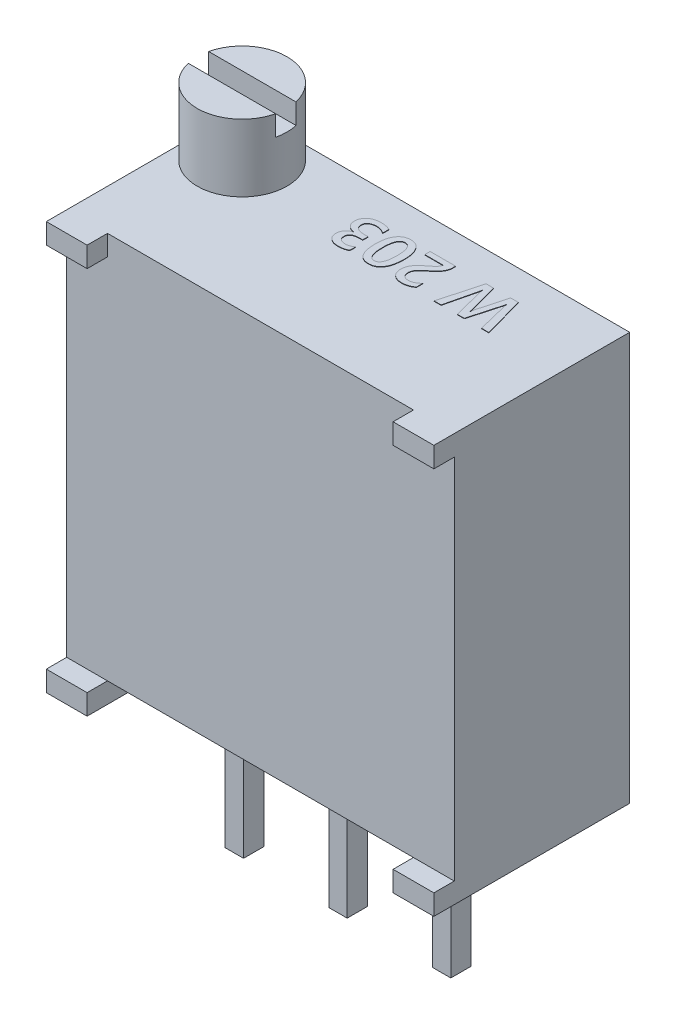
from build123d import *

# Parameters (mm, degrees)
BOSS_EXTRUDE1_DEPTH   = 4.3
SKETCH2_W             = 1
SKETCH2_H             = 0.5
BOSS_EXTRUDE2_DEPTH   = 0.5
SKETCH3_W             = 0.45
SKETCH3_H             = 0.5
BOSS_EXTRUDE3_DEPTH   = 4
BOSS_EXTRUDE3_2_DEPTH = 4
BOSS_EXTRUDE3_3_DEPTH = 4
SKETCH4_R             = 1.1
BOSS_EXTRUDE4_DEPTH   = 1.65
SKETCH5_W             = 2.5
SKETCH5_H             = 0.5
CUT_EXTRUDE1_DEPTH    = 0.5
BOSS_EXTRUDE5_DEPTH   = 0.01
SKETCH7_W             = 0.179487179
SKETCH7_H             = 1
BOSS_EXTRUDE6_DEPTH   = 0.01


with BuildPart() as part:
    # Sketch1 → Boss-Extrude1 (new body)
    with BuildSketch(Plane.XY):
        Polygon((-3.75, -4.75), (3.75, -4.75), (3.75, -5.25), (4.75, -5.25), (4.75, -4.75), (4.75, 4.75), (-4.75, 4.75), (-4.75, -4.75), (-4.75, -5.25), (-3.75, -5.25), align=None)
    extrude(amount=BOSS_EXTRUDE1_DEPTH)

    # Sketch2 → Boss-Extrude2 (add)
    with BuildSketch(Plane.XY.offset(4.3)):
        with Locations((-4.25, -5)):
            Rectangle(SKETCH2_W, SKETCH2_H)
        with Locations((4.25, -5)):
            Rectangle(SKETCH2_W, SKETCH2_H)
        with Locations((-4.25, 4.5)):
            Rectangle(SKETCH2_W, SKETCH2_H)
        with Locations((4.25, 4.5)):
            Rectangle(SKETCH2_W, SKETCH2_H)
    extrude(amount=BOSS_EXTRUDE2_DEPTH)

    # Sketch6 → Boss-Extrude5 (add)
    # profile 1 of 4: a face of its own
    with BuildSketch(Plane(origin=(0, 4.75, 0), x_dir=(1, 0, 0), z_dir=(0, 1, 0))):
        with BuildLine():
            Line((1.697104467, -1.740827386), (1.969925191, -0.740827386))
            Line((1.969925191, -0.740827386), (2.156602823, -0.740827386))
            Line((2.156602823, -0.740827386), (2.345953151, -1.440251728))
            add(Edge.make_bspline(
                [(2.345953151, -1.440251728), (2.349481354, -1.455751325), (2.356806518, -1.487931187), (2.359272146, -1.520846497), (2.360550191, -1.537907978)],
                knots=[0, 0, 0, 0, 0.963310326, 2, 2, 2, 2], degree=3))
            Line((2.360550191, -1.537907978), (2.363222888, -1.537907978))
            add(Edge.make_bspline(
                [(2.363222888, -1.537907978), (2.364797882, -1.521526116), (2.367921887, -1.489032641), (2.37591335, -1.45738372), (2.379875849, -1.441690873)],
                knots=[0, 0, 0, 0, 1.008317034, 2, 2, 2, 2], degree=3))
            Line((2.379875849, -1.441690873), (2.570048546, -0.740827386))
            Line((2.570048546, -0.740827386), (2.76083802, -0.740827386))
            Line((2.76083802, -0.740827386), (3.03920973, -1.740827386))
            Line((3.03920973, -1.740827386), (2.858083086, -1.740827386))
            Line((2.858083086, -1.740827386), (2.677573217, -1.008508307))
            add(Edge.make_bspline(
                [(2.677573217, -1.008508307), (2.674192154, -0.992867389), (2.667329759, -0.96112171), (2.664987027, -0.928725819), (2.663798546, -0.912291202)],
                knots=[0, 0, 0, 0, 0.985388796, 2, 2, 2, 2], degree=3))
            Line((2.663798546, -0.912291202), (2.66030348, -0.912291202))
            add(Edge.make_bspline(
                [(2.66030348, -0.912291202), (2.659640212, -0.918746129), (2.658200294, -0.932759404), (2.653783704, -0.955210106), (2.648091859, -0.980865207), (2.643308348, -0.998930476), (2.64077223, -1.008508307)],
                knots=[0, 0, 0, 0, 0.791790955, 1.718932655, 2.790625439, 4, 4, 4, 4], degree=3))
            Line((2.64077223, -1.008508307), (2.436824862, -1.740827386))
            Line((2.436824862, -1.740827386), (2.266800191, -1.740827386))
            Line((2.266800191, -1.740827386), (2.078066638, -1.00295732))
            add(Edge.make_bspline(
                [(2.078066638, -1.00295732), (2.076492147, -0.996392319), (2.073227537, -0.982780201), (2.069480094, -0.961270494), (2.065840635, -0.938132399), (2.064276351, -0.922033218), (2.063469599, -0.913730346)],
                knots=[0, 0, 0, 0, 0.894988931, 1.855703602, 2.894116632, 4, 4, 4, 4], degree=3))
            Line((2.063469599, -0.913730346), (2.060796901, -0.913730346))
            add(Edge.make_bspline(
                [(2.060796901, -0.913730346), (2.060229838, -0.920040213), (2.059012116, -0.933590109), (2.055941386, -0.955314057), (2.050801785, -0.979652109), (2.046846147, -0.996796835), (2.044760717, -1.005835609)],
                knots=[0, 0, 0, 0, 0.812174724, 1.74407555, 2.810666704, 4, 4, 4, 4], degree=3))
            Line((2.044760717, -1.005835609), (1.867951507, -1.740827386))
            Line((1.867951507, -1.740827386), (1.697104467, -1.740827386))
        make_face()
    # profile 2 of 4: a face of its own
    with BuildSketch(Plane(origin=(0, 4.75, 0), x_dir=(1, 0, 0), z_dir=(0, 1, 0))):
        with BuildLine():
            Line((0.598831441, -0.740827386), (1.223214665, -0.740827386))
            Line((1.223214665, -0.740827386), (1.223214665, -0.813812583))
            add(Edge.make_bspline(
                [(1.223214665, -0.813812583), (1.223063796, -0.821221518), (1.222765395, -0.835875506), (1.220147953, -0.85772297), (1.216140054, -0.879188212), (1.208361523, -0.907107739), (1.195435505, -0.940751899), (1.175323007, -0.978928145), (1.151178875, -1.014902269), (1.122837621, -1.048311288), (1.091899621, -1.080329827), (1.058917452, -1.111137302), (1.024520802, -1.140807695), (0.989630078, -1.169699196), (0.954469781, -1.197921452), (0.931451436, -1.217081514), (0.919966309, -1.226641531)],
                knots=[0, 0, 0, 0, 0.585695841, 1.1584363, 1.737703347, 2.310930754, 3.448241923, 4.580285727, 5.716615164, 6.867072204, 8.039917194, 9.236143289, 10.434724066, 11.631674228, 12.818311132, 14, 14, 14, 14], degree=3))
            add(Edge.make_bspline(
                [(0.919966309, -1.226641531), (0.909766271, -1.235624059), (0.889962237, -1.25306422), (0.86207785, -1.279499675), (0.837127507, -1.306035465), (0.816263462, -1.333819235), (0.799300365, -1.362930288), (0.78649894, -1.393576025), (0.778557756, -1.426629466), (0.777582407, -1.449458179), (0.777079796, -1.461222123)],
                knots=[0, 0, 0, 0, 1.146517297, 2.226037423, 3.240694149, 4.215431384, 5.150528787, 6.075997236, 7.008535445, 8, 8, 8, 8], degree=3))
            add(Edge.make_bspline(
                [(0.777079796, -1.461222123), (0.77723676, -1.467740783), (0.777540124, -1.480339387), (0.779903318, -1.498625395), (0.783411006, -1.515707992), (0.788919559, -1.53140217), (0.795411732, -1.545968043), (0.803540224, -1.559089795), (0.812586823, -1.571171236), (0.822951055, -1.581931562), (0.834514294, -1.591392979), (0.847090227, -1.599598872), (0.860565877, -1.606674106), (0.880028938, -1.614398169), (0.906687925, -1.6208858), (0.928764817, -1.621890055), (0.940114336, -1.622406333)],
                knots=[0, 0, 0, 0, 1.054824817, 2.038658003, 2.980829736, 3.871915045, 4.725761204, 5.557188573, 6.364814103, 7.165091863, 7.969051903, 8.778275864, 9.592049471, 10.428420805, 12.163885205, 14, 14, 14, 14], degree=3))
            add(Edge.make_bspline(
                [(0.940114336, -1.622406333), (0.950347482, -1.622025692), (0.971084598, -1.621254335), (1.002171835, -1.615663603), (1.033525132, -1.60675338), (1.064885559, -1.594119206), (1.096246721, -1.578127486), (1.126881495, -1.558090504), (1.157316218, -1.534994561), (1.176162249, -1.51706014), (1.185796901, -1.507891531)],
                knots=[0, 0, 0, 0, 0.883493664, 1.790369133, 2.719623939, 3.694504142, 4.705684263, 5.754764511, 6.852168812, 8, 8, 8, 8], degree=3))
            Line((1.185796901, -1.507891531), (1.185796901, -1.662907978))
            add(Edge.make_bspline(
                [(1.185796901, -1.662907978), (1.175622414, -1.670258535), (1.155679728, -1.684666124), (1.124428811, -1.703314019), (1.092433479, -1.718780855), (1.059615678, -1.731936381), (1.025227854, -1.742112607), (0.989001163, -1.749006089), (0.950697519, -1.753171818), (0.924431728, -1.753708965), (0.910920257, -1.753985281)],
                knots=[0, 0, 0, 0, 1.020217626, 1.999695649, 2.954129611, 3.907082353, 4.871483213, 5.864810139, 6.901630029, 8, 8, 8, 8], degree=3))
            add(Edge.make_bspline(
                [(0.910920257, -1.753985281), (0.899944022, -1.753838162), (0.87848047, -1.753550477), (0.847094745, -1.749827286), (0.817228196, -1.744424536), (0.788976158, -1.736668315), (0.762639859, -1.726476741), (0.737958269, -1.714689827), (0.715473743, -1.700377653), (0.694911191, -1.684068653), (0.676550198, -1.665498971), (0.660446881, -1.644731141), (0.646328011, -1.621981395), (0.634637885, -1.597002724), (0.625347008, -1.569994154), (0.618920717, -1.541023209), (0.614577468, -1.510215569), (0.614225983, -1.488992951), (0.614045257, -1.478080675)],
                knots=[0, 0, 0, 0, 1.145543965, 2.240061654, 3.295540143, 4.312948294, 5.293759512, 6.241105975, 7.164277889, 8.070655315, 8.976439294, 9.88400245, 10.809445939, 11.766606939, 12.757831477, 13.785531283, 14.861361287, 16, 16, 16, 16], degree=3))
            add(Edge.make_bspline(
                [(0.614045257, -1.478080675), (0.614274215, -1.468207674), (0.61472185, -1.448905099), (0.617294014, -1.420633556), (0.62210177, -1.393933953), (0.628407073, -1.368595802), (0.636820966, -1.344546665), (0.646636431, -1.321399846), (0.657969075, -1.299027197), (0.671062561, -1.27763972), (0.685423564, -1.256740543), (0.701619195, -1.236707231), (0.718792169, -1.216848322), (0.744475269, -1.190998448), (0.779383255, -1.15839091), (0.809039378, -1.133311645), (0.82436598, -1.120350412)],
                knots=[0, 0, 0, 0, 0.960422525, 1.877709569, 2.757692884, 3.59673609, 4.414622526, 5.232970578, 6.040827254, 6.851319506, 7.670427297, 8.505303329, 9.355576882, 10.222871562, 12.04793961, 14, 14, 14, 14], degree=3))
            add(Edge.make_bspline(
                [(0.82436598, -1.120350412), (0.837695836, -1.109480538), (0.864181193, -1.087882967), (0.903862983, -1.056738396), (0.94146313, -1.026350281), (0.97555324, -0.996590955), (1.00473997, -0.967058619), (1.024688843, -0.94169429), (1.036674552, -0.921267569), (1.0430059, -0.906234329), (1.046900133, -0.891107384), (1.047394871, -0.880925696), (1.047639007, -0.875901399)],
                knots=[0, 0, 0, 0, 1.519319933, 3.018767352, 4.455867251, 5.789607442, 7.013970974, 8.119420078, 8.629257675, 9.101441908, 9.55659382, 10, 10, 10, 10], degree=3))
            Line((1.047639007, -0.875901399), (1.047639007, -0.872406333))
            Line((1.047639007, -0.872406333), (0.598831441, -0.872406333))
            Line((0.598831441, -0.872406333), (0.598831441, -0.740827386))
        make_face()
    # profile 3 of 4: a face of its own
    with BuildSketch(Plane(origin=(0, 4.75, 0), x_dir=(1, 0, 0), z_dir=(0, 1, 0))):
        with BuildLine():
            add(Edge.make_bspline(
                [(0.118157099, -0.727669491), (0.130791593, -0.72805702), (0.155453254, -0.728813451), (0.191347305, -0.734938786), (0.225117321, -0.744805127), (0.256873898, -0.7585849), (0.286279065, -0.776749909), (0.313602604, -0.798665967), (0.338644744, -0.824706542), (0.361457304, -0.854581186), (0.381665196, -0.888263301), (0.399825732, -0.925195065), (0.414314507, -0.966009555), (0.426794305, -1.010059924), (0.435993253, -1.057821363), (0.443094935, -1.108928031), (0.446824004, -1.163675022), (0.447415906, -1.201280314), (0.447721244, -1.220679359)],
                knots=[0, 0, 0, 0, 0.908194589, 1.772733203, 2.610198082, 3.433401534, 4.254166997, 5.088537112, 5.945966099, 6.845966122, 7.785889167, 8.766785405, 9.80052806, 10.895912427, 12.056765169, 13.295366077, 14.604788982, 16, 16, 16, 16], degree=3))
            add(Edge.make_bspline(
                [(0.447721244, -1.220679359), (0.447469784, -1.241932646), (0.446981723, -1.283183383), (0.442521891, -1.343010411), (0.43581371, -1.398947854), (0.425657279, -1.450839658), (0.413105879, -1.498883053), (0.39752545, -1.542886841), (0.378998663, -1.582854085), (0.357634885, -1.618807973), (0.333546493, -1.650589967), (0.307033861, -1.678344237), (0.277800538, -1.701794978), (0.245989125, -1.720984124), (0.211659034, -1.736018198), (0.174768519, -1.74633684), (0.135458696, -1.752947232), (0.10838479, -1.753633622), (0.094514007, -1.753985281)],
                knots=[0, 0, 0, 0, 1.412202202, 2.740958721, 3.984857896, 5.154044097, 6.252128862, 7.282102455, 8.25196091, 9.175176518, 10.056000901, 10.896678907, 11.719614964, 12.538951468, 13.358844723, 14.202133996, 15.078898714, 16, 16, 16, 16], degree=3))
            add(Edge.make_bspline(
                [(0.094514007, -1.753985281), (0.08126312, -1.753600211), (0.055443601, -1.752849898), (0.017986802, -1.74673435), (-0.017040185, -1.737014601), (-0.049389832, -1.722902002), (-0.07909995, -1.704817421), (-0.106313132, -1.682800719), (-0.130855482, -1.656684281), (-0.152737211, -1.626605074), (-0.171898295, -1.592537765), (-0.18844492, -1.554537056), (-0.202673437, -1.512603357), (-0.213975247, -1.466622001), (-0.223042849, -1.4167817), (-0.229198413, -1.363004904), (-0.23323563, -1.305308273), (-0.233618664, -1.265505847), (-0.233816585, -1.244939228)],
                knots=[0, 0, 0, 0, 0.927272819, 1.806802712, 2.649751481, 3.466272407, 4.269403807, 5.077948948, 5.90951417, 6.771315089, 7.675916582, 8.640522845, 9.669262054, 10.772456733, 11.952629878, 13.213732683, 14.560286302, 16, 16, 16, 16], degree=3))
            add(Edge.make_bspline(
                [(-0.233816585, -1.244939228), (-0.233557674, -1.22457714), (-0.233054054, -1.184969902), (-0.228672515, -1.127453484), (-0.221694229, -1.073572385), (-0.211308516, -1.023542944), (-0.198651552, -0.977067833), (-0.18239271, -0.934531303), (-0.163937687, -0.895392573), (-0.141977882, -0.860385952), (-0.117752504, -0.829079534), (-0.090874501, -0.801963896), (-0.061691, -0.778936714), (-0.030243018, -0.759995831), (0.003662493, -0.745623215), (0.039702427, -0.735002044), (0.078195068, -0.728800456), (0.104634186, -0.728052203), (0.118157099, -0.727669491)],
                knots=[0, 0, 0, 0, 1.38560465, 2.695203706, 3.923414753, 5.08051981, 6.170289562, 7.197649644, 8.176009219, 9.110401701, 10.004207552, 10.864985215, 11.70194331, 12.528215922, 13.355593529, 14.201278052, 15.080001062, 16, 16, 16, 16], degree=3))
        make_face()
        with BuildLine():
            add(Edge.make_bspline(
                [(0.102120915, -1.622406333), (0.109486281, -1.622192568), (0.1238329, -1.621776186), (0.14450597, -1.616682511), (0.163956153, -1.609217333), (0.181719844, -1.597953269), (0.19845217, -1.584166159), (0.213170728, -1.566777951), (0.226653544, -1.546557429), (0.238716989, -1.523328517), (0.249092192, -1.496938827), (0.25839091, -1.467630653), (0.266047441, -1.435172846), (0.272395354, -1.399688281), (0.277281642, -1.36118995), (0.280631249, -1.319546629), (0.283039364, -1.274846685), (0.283176763, -1.243983306), (0.283247559, -1.228080675)],
                knots=[0, 0, 0, 0, 0.735362069, 1.432374033, 2.118779267, 2.811561237, 3.527183876, 4.280708889, 5.081467683, 5.955679666, 6.894233009, 7.915781384, 9.0302243, 10.228785287, 11.521728145, 12.91191762, 14.408838127, 16, 16, 16, 16], degree=3))
            add(Edge.make_bspline(
                [(0.283247559, -1.228080675), (0.283153891, -1.213206842), (0.2829725, -1.184403236), (0.280878036, -1.142569375), (0.277504851, -1.103595824), (0.272533143, -1.067522615), (0.266494246, -1.034335731), (0.258939489, -1.004025576), (0.249913947, -0.976515569), (0.239524061, -0.951859156), (0.227813576, -0.930006013), (0.214624734, -0.911104499), (0.199952596, -0.895052416), (0.183788967, -0.881979998), (0.166286398, -0.87168555), (0.147320684, -0.864468568), (0.126929163, -0.860016315), (0.112834897, -0.859508523), (0.10561598, -0.859248438)],
                knots=[0, 0, 0, 0, 1.571596828, 3.04344242, 4.424859977, 5.704017907, 6.889997985, 7.987729224, 9.002212153, 9.94644074, 10.811633262, 11.617285478, 12.375763891, 13.101849371, 13.806082749, 14.512138209, 15.237934729, 16, 16, 16, 16], degree=3))
            add(Edge.make_bspline(
                [(0.10561598, -0.859248438), (0.098534702, -0.859511081), (0.084712879, -0.860023729), (0.064625066, -0.864457488), (0.045956469, -0.871912592), (0.02865925, -0.882403485), (0.012713534, -0.895693931), (-0.001814211, -0.9119725), (-0.014726933, -0.931271724), (-0.026177616, -0.953477094), (-0.036471723, -0.978428919), (-0.045211388, -1.006393716), (-0.05278935, -1.037216362), (-0.058894174, -1.071003912), (-0.063504691, -1.107661485), (-0.067015363, -1.147225852), (-0.06905695, -1.189750227), (-0.069245561, -1.219100924), (-0.069342901, -1.234248438)],
                knots=[0, 0, 0, 0, 0.74148903, 1.447299324, 2.143506309, 2.83945391, 3.558586653, 4.311330362, 5.118123385, 5.985524726, 6.925864811, 7.943480589, 9.053125395, 10.250577148, 11.53966483, 12.924071925, 14.412553285, 16, 16, 16, 16], degree=3))
            add(Edge.make_bspline(
                [(-0.069342901, -1.234248438), (-0.069256872, -1.249945019), (-0.069090744, -1.280256303), (-0.066904853, -1.324269413), (-0.063820757, -1.36523533), (-0.059008699, -1.403219624), (-0.053247913, -1.438128677), (-0.045795151, -1.470050488), (-0.037116021, -1.498946705), (-0.026966476, -1.524840469), (-0.015897768, -1.5478391), (-0.002888655, -1.567539081), (0.010892915, -1.584682311), (0.026632618, -1.598410685), (0.043517505, -1.609366095), (0.062012606, -1.616643215), (0.081558459, -1.621773112), (0.095164397, -1.622192107), (0.102120915, -1.622406333)],
                knots=[0, 0, 0, 0, 1.611006825, 3.110976005, 4.522342957, 5.826738026, 7.039854268, 8.152351257, 9.189293333, 10.133733214, 11.005142595, 11.803131833, 12.552481119, 13.255248608, 13.938270181, 14.607089561, 15.287825258, 16, 16, 16, 16], degree=3))
        make_face(mode=Mode.SUBTRACT)
    # profile 4 of 4: a face of its own
    with BuildSketch(Plane(origin=(0, 4.75, 0), x_dir=(1, 0, 0), z_dir=(0, 1, 0))):
        with BuildLine():
            Line((-0.373002441, -0.780917846), (-0.373002441, -0.932028044))
            add(Edge.make_bspline(
                [(-0.373002441, -0.932028044), (-0.38113445, -0.926201487), (-0.397258025, -0.914649003), (-0.422895333, -0.899868456), (-0.449236858, -0.887333515), (-0.476324182, -0.876839754), (-0.504347692, -0.869230833), (-0.532951951, -0.863306885), (-0.562414763, -0.860047283), (-0.582287922, -0.859517293), (-0.592369217, -0.859248438)],
                knots=[0, 0, 0, 0, 1.020040626, 2.02246448, 3.013734284, 3.993997349, 4.98119114, 5.972460943, 6.971466046, 8, 8, 8, 8], degree=3))
            add(Edge.make_bspline(
                [(-0.592369217, -0.859248438), (-0.600391694, -0.859348391), (-0.616121825, -0.859544373), (-0.639068948, -0.861614356), (-0.660854243, -0.865095956), (-0.681323245, -0.870018961), (-0.7006199, -0.876147488), (-0.718636744, -0.883823214), (-0.73543138, -0.892822359), (-0.75095022, -0.903042018), (-0.76463729, -0.914652257), (-0.777065512, -0.926884792), (-0.787006429, -0.940682982), (-0.795702112, -0.955055466), (-0.801913713, -0.970676655), (-0.806867769, -0.987070444), (-0.809398802, -1.004593298), (-0.809857685, -1.016588577), (-0.810091256, -1.022694162)],
                knots=[0, 0, 0, 0, 1.258895949, 2.468389337, 3.612503448, 4.718673703, 5.769764423, 6.786671876, 7.787639893, 8.757195985, 9.696445932, 10.601570915, 11.485745881, 12.35832979, 13.231245116, 14.116270219, 15.04118342, 16, 16, 16, 16], degree=3))
            add(Edge.make_bspline(
                [(-0.810091256, -1.022694162), (-0.80990817, -1.029356016), (-0.809549376, -1.042411273), (-0.806332599, -1.061281949), (-0.801594732, -1.079018073), (-0.794116466, -1.095187068), (-0.785174113, -1.110325271), (-0.773928072, -1.124031786), (-0.760503085, -1.136215505), (-0.745326169, -1.147346768), (-0.72801939, -1.157002332), (-0.708790404, -1.165538125), (-0.687335206, -1.172272872), (-0.66411663, -1.178343149), (-0.638819813, -1.18284909), (-0.611470361, -1.185717562), (-0.582125514, -1.187946664), (-0.561877772, -1.188111148), (-0.551456388, -1.188195807)],
                knots=[0, 0, 0, 0, 0.919773204, 1.802482531, 2.638870844, 3.448454622, 4.255597885, 5.063129906, 5.887422618, 6.75491477, 7.658160222, 8.620620861, 9.656755447, 10.761500027, 11.935428112, 13.202873052, 14.560336558, 16, 16, 16, 16], degree=3))
            Line((-0.551456388, -1.188195807), (-0.474359349, -1.188195807))
            Line((-0.474359349, -1.188195807), (-0.474359349, -1.319774754))
            Line((-0.474359349, -1.319774754), (-0.547961322, -1.319774754))
            add(Edge.make_bspline(
                [(-0.547961322, -1.319774754), (-0.557216171, -1.319886442), (-0.575197113, -1.320103437), (-0.601277831, -1.321964344), (-0.625585786, -1.324992592), (-0.648061718, -1.329260504), (-0.668748775, -1.33482172), (-0.687714334, -1.341515243), (-0.70480878, -1.349588652), (-0.720286206, -1.358560627), (-0.733713026, -1.369207862), (-0.745549902, -1.380919533), (-0.755524036, -1.393993161), (-0.763562742, -1.40836184), (-0.769969606, -1.423806346), (-0.774518768, -1.440514713), (-0.777211767, -1.458460687), (-0.77747326, -1.470875406), (-0.777607704, -1.477258307)],
                knots=[0, 0, 0, 0, 1.404501108, 2.728759148, 3.965970751, 5.120544592, 6.19790431, 7.214506404, 8.168354262, 9.063819676, 9.923158143, 10.761596165, 11.585390412, 12.409775404, 13.253871661, 14.116853272, 15.031799295, 16, 16, 16, 16], degree=3))
            add(Edge.make_bspline(
                [(-0.777607704, -1.477258307), (-0.777534558, -1.483092432), (-0.777391965, -1.494465712), (-0.774972856, -1.510963595), (-0.771534331, -1.526377233), (-0.76693063, -1.540775311), (-0.760367249, -1.55376152), (-0.752780436, -1.565905126), (-0.7435462, -1.576751324), (-0.732779061, -1.586326885), (-0.720916798, -1.594957709), (-0.70756865, -1.602496252), (-0.692714619, -1.608488464), (-0.676603141, -1.613743474), (-0.659020596, -1.617517962), (-0.640081716, -1.620444344), (-0.619739156, -1.622012925), (-0.605735029, -1.622272773), (-0.59853698, -1.622406333)],
                knots=[0, 0, 0, 0, 1.061395487, 2.069127569, 3.028812431, 3.936457015, 4.81267355, 5.671205055, 6.538848535, 7.39592767, 8.289566421, 9.205919675, 10.179300053, 11.201455343, 12.288367393, 13.44967409, 14.689145545, 16, 16, 16, 16], degree=3))
            add(Edge.make_bspline(
                [(-0.59853698, -1.622406333), (-0.59023095, -1.622240273), (-0.57375767, -1.621910926), (-0.54932288, -1.618295646), (-0.525083155, -1.613384878), (-0.501386479, -1.605586793), (-0.477873592, -1.596141413), (-0.454906577, -1.584322349), (-0.432175713, -1.570582943), (-0.41774271, -1.559953652), (-0.410420204, -1.554560938)],
                knots=[0, 0, 0, 0, 0.977927317, 1.939514914, 2.905635295, 3.888849374, 4.874051084, 5.888857151, 6.928923011, 8, 8, 8, 8], degree=3))
            Line((-0.410420204, -1.554560938), (-0.410420204, -1.697241859))
            add(Edge.make_bspline(
                [(-0.410420204, -1.697241859), (-0.418987214, -1.701835271), (-0.436218496, -1.711074242), (-0.463443542, -1.722463476), (-0.491757286, -1.732147738), (-0.521132482, -1.740194036), (-0.551716708, -1.746303142), (-0.583416611, -1.750851969), (-0.616306973, -1.75356787), (-0.638622365, -1.753844862), (-0.649935006, -1.753985281)],
                knots=[0, 0, 0, 0, 0.937084458, 1.884807541, 2.842116104, 3.82179766, 4.819900794, 5.848100763, 6.90910883, 8, 8, 8, 8], degree=3))
            add(Edge.make_bspline(
                [(-0.649935006, -1.753985281), (-0.660700585, -1.7537904), (-0.681729616, -1.753409729), (-0.712480004, -1.750369221), (-0.741504832, -1.744912319), (-0.769049583, -1.737910145), (-0.794802564, -1.728235615), (-0.819220254, -1.717134118), (-0.841721341, -1.703376802), (-0.862466071, -1.687829663), (-0.881042757, -1.670599523), (-0.897609823, -1.652294869), (-0.911070647, -1.632334825), (-0.922591563, -1.61159463), (-0.931224492, -1.589428839), (-0.937647413, -1.566239414), (-0.941396811, -1.541730154), (-0.941850229, -1.52503688), (-0.942081388, -1.516526399)],
                knots=[0, 0, 0, 0, 1.223600096, 2.390129341, 3.506991535, 4.578292298, 5.615841666, 6.629967304, 7.622563525, 8.607180547, 9.571875333, 10.498880206, 11.406369787, 12.302217071, 13.190377456, 14.103134075, 15.032949347, 16, 16, 16, 16], degree=3))
            add(Edge.make_bspline(
                [(-0.942081388, -1.516526399), (-0.941913091, -1.50850314), (-0.941584441, -1.492835253), (-0.939319978, -1.469873848), (-0.935448154, -1.447999642), (-0.929873693, -1.427253126), (-0.922910012, -1.407532436), (-0.914194238, -1.389006047), (-0.904114083, -1.371403668), (-0.892397292, -1.354892666), (-0.878892143, -1.339676202), (-0.864101816, -1.325436646), (-0.847668369, -1.312336521), (-0.829555238, -1.300518483), (-0.809966944, -1.289615761), (-0.788926663, -1.279676296), (-0.766212894, -1.271049355), (-0.750364407, -1.266291143), (-0.742245862, -1.263853702)],
                knots=[0, 0, 0, 0, 1.098595234, 2.145346005, 3.15592675, 4.137015446, 5.083892102, 6.015911009, 6.936617318, 7.858422922, 8.782709067, 9.71854687, 10.666771129, 11.655816299, 12.676671095, 13.734552038, 14.839501629, 16, 16, 16, 16], degree=3))
            Line((-0.742245862, -1.263853702), (-0.742245862, -1.261181004))
            add(Edge.make_bspline(
                [(-0.742245862, -1.261181004), (-0.750968968, -1.26014416), (-0.768103579, -1.25810751), (-0.792917602, -1.252940643), (-0.816413055, -1.246196641), (-0.838345775, -1.237473847), (-0.859119246, -1.227483144), (-0.878362803, -1.215416233), (-0.896176612, -1.201695458), (-0.912515701, -1.186426345), (-0.92705127, -1.169783034), (-0.939905075, -1.152093466), (-0.950599248, -1.133316938), (-0.959350497, -1.113546533), (-0.966051044, -1.092787368), (-0.971093077, -1.071003437), (-0.973929111, -1.048194118), (-0.974350997, -1.032638529), (-0.974564941, -1.024750083)],
                knots=[0, 0, 0, 0, 1.147413426, 2.253839573, 3.308008183, 4.33735214, 5.334565654, 6.316054888, 7.299380704, 8.268702586, 9.233255888, 10.182642181, 11.121197407, 12.051341855, 13.002837429, 13.967349162, 14.969215829, 16, 16, 16, 16], degree=3))
            add(Edge.make_bspline(
                [(-0.974564941, -1.024750083), (-0.974249505, -1.013904131), (-0.973631493, -0.992654376), (-0.968757649, -0.961568621), (-0.960980978, -0.93205073), (-0.950128195, -0.904074771), (-0.93568841, -0.877953917), (-0.918281899, -0.853374114), (-0.897908594, -0.830162218), (-0.874104381, -0.809211488), (-0.848191245, -0.789830801), (-0.819880333, -0.773195016), (-0.789583996, -0.759093664), (-0.757264097, -0.747689806), (-0.723043508, -0.738569308), (-0.686782996, -0.732315965), (-0.648587628, -0.72828238), (-0.622396311, -0.727876663), (-0.609022177, -0.727669491)],
                knots=[0, 0, 0, 0, 0.983940476, 1.927769423, 2.84802486, 3.750045942, 4.643514009, 5.549450475, 6.479157115, 7.439340576, 8.422041893, 9.411900921, 10.413607991, 11.450326742, 12.518416784, 13.623775064, 14.786622743, 16, 16, 16, 16], degree=3))
            add(Edge.make_bspline(
                [(-0.609022177, -0.727669491), (-0.597024525, -0.727817452), (-0.573619524, -0.728106095), (-0.539446627, -0.730636467), (-0.507013963, -0.734619547), (-0.476560408, -0.740628986), (-0.447836602, -0.747921014), (-0.421195543, -0.757302381), (-0.396034788, -0.767751125), (-0.380597191, -0.776576215), (-0.373002441, -0.780917846)],
                knots=[0, 0, 0, 0, 1.175824548, 2.293796582, 3.356926285, 4.376576327, 5.334578578, 6.258657363, 7.143321063, 8, 8, 8, 8], degree=3))
        make_face()
    extrude(amount=BOSS_EXTRUDE5_DEPTH)

    # Sketch7 → Boss-Extrude6 (add)
    # profile 1 of 13: a face of its own
    with BuildSketch(Plane(origin=(0, 0, 0), x_dir=(-1, 0, 0), z_dir=(0, 0, -1))):
        Polygon((-2.975524587, 1.868364311), (-2.437063048, 1.868364311), (-2.437063048, 1.688877132), (-2.616550228, 1.688877132), (-2.616550228, 0.868364311), (-2.796037407, 0.868364311), (-2.796037407, 1.688877132), (-2.975524587, 1.688877132), align=None)
    # profile 2 of 13: a face of its own
    with BuildSketch(Plane(origin=(0, 0, 0), x_dir=(-1, 0, 0), z_dir=(0, 0, -1))):
        with BuildLine():
            Line((-2.296037407, 1.868364311), (-2.086902792, 1.868364311))
            add(Edge.make_bspline(
                [(-2.086902792, 1.868364311), (-2.073079057, 1.868315245), (-2.046492122, 1.868220876), (-2.008155214, 1.866731994), (-1.972937491, 1.864660091), (-1.940786811, 1.861498313), (-1.911716929, 1.857306177), (-1.885698709, 1.852364342), (-1.862732913, 1.846732062), (-1.842625854, 1.839713797), (-1.824480228, 1.831797301), (-1.807565982, 1.822701101), (-1.791509963, 1.812526487), (-1.776419487, 1.801005737), (-1.762163414, 1.788346107), (-1.748714851, 1.774534854), (-1.736263837, 1.759454863), (-1.72488747, 1.743201422), (-1.714518827, 1.726103174), (-1.705355121, 1.708136644), (-1.69790318, 1.689289337), (-1.691318592, 1.669833638), (-1.686575926, 1.649491424), (-1.683277471, 1.628460729), (-1.680862472, 1.606667522), (-1.680723621, 1.591862186), (-1.680652792, 1.584309824)],
                knots=[0, 0, 0, 0, 1.749336639, 3.364467119, 4.854658419, 6.213483162, 7.451590619, 8.570285859, 9.5643256, 10.440900261, 11.26203566, 12.067320669, 12.869050712, 13.665104639, 14.467235401, 15.27997916, 16.102287765, 16.939272006, 17.78853747, 18.631303466, 19.488103222, 20.351255419, 21.228522269, 22.127379805, 23.044756219, 24, 24, 24, 24], degree=3))
            add(Edge.make_bspline(
                [(-1.680652792, 1.584309824), (-1.680836781, 1.576426893), (-1.68119755, 1.560969902), (-1.68314085, 1.538264843), (-1.686692591, 1.51654223), (-1.69207222, 1.495865666), (-1.698255404, 1.475977805), (-1.706477453, 1.457245592), (-1.715756849, 1.439396593), (-1.726777715, 1.422683289), (-1.738872578, 1.406734445), (-1.752938649, 1.39216112), (-1.768064663, 1.378180052), (-1.785100908, 1.365666969), (-1.80329641, 1.353775781), (-1.823012696, 1.342999198), (-1.84412109, 1.333066321), (-1.858961336, 1.327527063), (-1.866550228, 1.324694439)],
                knots=[0, 0, 0, 0, 1.099860209, 2.156625411, 3.176576793, 4.16617041, 5.135385252, 6.078461593, 7.016046972, 7.938469504, 8.868247731, 9.803980173, 10.76021508, 11.73834243, 12.748633912, 13.790971185, 14.870363756, 16, 16, 16, 16], degree=3))
            Line((-1.866550228, 1.324694439), (-1.635780997, 0.868364311))
            Line((-1.635780997, 0.868364311), (-1.835300228, 0.868364311))
            Line((-1.835300228, 0.868364311), (-2.055652792, 1.304261747))
            Line((-2.055652792, 1.304261747), (-2.116550228, 1.304261747))
            Line((-2.116550228, 1.304261747), (-2.116550228, 0.868364311))
            Line((-2.116550228, 0.868364311), (-2.296037407, 0.868364311))
            Line((-2.296037407, 0.868364311), (-2.296037407, 1.868364311))
        make_face()
        with BuildLine():
            Line((-2.116550228, 1.483748926), (-2.046638369, 1.483748926))
            add(Edge.make_bspline(
                [(-2.046638369, 1.483748926), (-2.038091063, 1.483845192), (-2.021724809, 1.48402952), (-1.998187985, 1.484884508), (-1.976810937, 1.486944608), (-1.957501862, 1.489547467), (-1.940163601, 1.492552844), (-1.924950803, 1.496859732), (-1.911629063, 1.501474671), (-1.900356244, 1.507209843), (-1.890725007, 1.513731977), (-1.88240905, 1.521141284), (-1.875530561, 1.529716613), (-1.869869214, 1.539224925), (-1.865465301, 1.549750316), (-1.862250782, 1.561177244), (-1.860454342, 1.573635874), (-1.860247655, 1.582234026), (-1.860139971, 1.58671367)],
                knots=[0, 0, 0, 0, 1.688639943, 3.233382647, 4.650958383, 5.928841754, 7.082724185, 8.122798841, 9.049171256, 9.863274652, 10.613301712, 11.341792392, 12.054588806, 12.776240173, 13.521029143, 14.301969904, 15.115324896, 16, 16, 16, 16], degree=3))
            add(Edge.make_bspline(
                [(-1.860139971, 1.58671367), (-1.860343557, 1.592013416), (-1.860743465, 1.602423785), (-1.86471179, 1.617411066), (-1.871028506, 1.63128282), (-1.879686994, 1.643976371), (-1.890591234, 1.655104414), (-1.903104709, 1.664913873), (-1.917497491, 1.672670458), (-1.930824124, 1.67778662), (-1.942948245, 1.680847672), (-1.953889882, 1.683128741), (-1.966560363, 1.6847454), (-1.980969255, 1.686460155), (-1.997079827, 1.687572086), (-2.014979893, 1.688383575), (-2.034618044, 1.688715595), (-2.0483077, 1.688821736), (-2.055452471, 1.688877132)],
                knots=[0, 0, 0, 0, 1.020303359, 2.004196876, 2.966617323, 3.9489082, 4.950758222, 5.960522915, 7.003732012, 8.091992268, 8.70421221, 9.413913587, 10.24622431, 11.166358409, 12.212345909, 13.359657661, 14.621978493, 16, 16, 16, 16], degree=3))
            Line((-2.055452471, 1.688877132), (-2.116550228, 1.688877132))
            Line((-2.116550228, 1.688877132), (-2.116550228, 1.483748926))
        make_face(mode=Mode.SUBTRACT)
    # profile 3 of 13: a face of its own
    with BuildSketch(Plane(origin=(0, 0, 0), x_dir=(-1, 0, 0), z_dir=(0, 0, -1))):
        with Locations((-1.424242536, 1.368364311)):
            Rectangle(SKETCH7_W, SKETCH7_H)
    # profile 4 of 13: a face of its own
    with BuildSketch(Plane(origin=(0, 0, 0), x_dir=(-1, 0, 0), z_dir=(0, 0, -1))):
        Polygon((-1.024603112, 1.868364311), (-0.838305035, 1.868364311), (-0.610139971, 1.170848285), (-0.380372343, 1.868364311), (-0.195877151, 1.868364311), (-0.026806638, 0.868364311), (-0.208497343, 0.868364311), (-0.315268176, 1.499974888), (-0.523200869, 0.868364311), (-0.698280997, 0.868364311), (-0.905011766, 1.499974888), (-1.011582279, 0.868364311), (-1.193473305, 0.868364311), align=None)
    # profile 5 of 13: a face of its own
    with BuildSketch(Plane(origin=(0, 0, 0), x_dir=(-1, 0, 0), z_dir=(0, 0, -1))):
        Polygon((0.218986631, 1.868364311), (0.405284708, 1.868364311), (0.633449772, 1.170848285), (0.863217401, 1.868364311), (1.047712593, 1.868364311), (1.216783106, 0.868364311), (1.035092401, 0.868364311), (0.928321567, 1.499974888), (0.720388875, 0.868364311), (0.545308747, 0.868364311), (0.338577978, 1.499974888), (0.232007465, 0.868364311), (0.050116439, 0.868364311), align=None)
    # profile 6 of 13: a face of its own
    with BuildSketch(Plane(origin=(0, 0, 0), x_dir=(-1, 0, 0), z_dir=(0, 0, -1))):
        Polygon((1.383449772, 1.868364311), (1.921911311, 1.868364311), (1.921911311, 1.688877132), (1.562936952, 1.688877132), (1.562936952, 1.496569439), (1.921911311, 1.496569439), (1.921911311, 1.31708226), (1.562936952, 1.31708226), (1.562936952, 1.047851491), (1.921911311, 1.047851491), (1.921911311, 0.868364311), (1.383449772, 0.868364311), align=None)
    # profile 7 of 13: a face of its own
    with BuildSketch(Plane(origin=(0, 0, 0), x_dir=(-1, 0, 0), z_dir=(0, 0, -1))):
        with BuildLine():
            Line((2.10139849, 1.868364311), (2.310533106, 1.868364311))
            add(Edge.make_bspline(
                [(2.310533106, 1.868364311), (2.32435684, 1.868315245), (2.350943775, 1.868220876), (2.389280684, 1.866731994), (2.424498406, 1.864660091), (2.456649086, 1.861498313), (2.485718968, 1.857306177), (2.511737188, 1.852364342), (2.534702985, 1.846732062), (2.554810043, 1.839713797), (2.572955669, 1.831797301), (2.589869915, 1.822701101), (2.605925935, 1.812526487), (2.621016411, 1.801005737), (2.635272483, 1.788346107), (2.648721047, 1.774534854), (2.66117206, 1.759454863), (2.672548428, 1.743201422), (2.682917071, 1.726103174), (2.692080776, 1.708136644), (2.699532717, 1.689289337), (2.706117306, 1.669833638), (2.710859971, 1.649491424), (2.714158426, 1.628460729), (2.716573425, 1.606667522), (2.716712276, 1.591862186), (2.716783106, 1.584309824)],
                knots=[0, 0, 0, 0, 1.749336639, 3.364467119, 4.854658419, 6.213483162, 7.451590619, 8.570285859, 9.5643256, 10.440900261, 11.26203566, 12.067320669, 12.869050712, 13.665104639, 14.467235401, 15.27997916, 16.102287765, 16.939272006, 17.78853747, 18.631303466, 19.488103222, 20.351255419, 21.228522269, 22.127379805, 23.044756219, 24, 24, 24, 24], degree=3))
            add(Edge.make_bspline(
                [(2.716783106, 1.584309824), (2.716599117, 1.576426893), (2.716238347, 1.560969902), (2.714295048, 1.538264843), (2.710743306, 1.51654223), (2.705363678, 1.495865666), (2.699180493, 1.475977805), (2.690958444, 1.457245592), (2.681679049, 1.439396593), (2.670658182, 1.422683289), (2.658563319, 1.406734445), (2.644497248, 1.39216112), (2.629371235, 1.378180052), (2.61233499, 1.365666969), (2.594139487, 1.353775781), (2.574423201, 1.342999198), (2.553314807, 1.333066321), (2.538474561, 1.327527063), (2.53088567, 1.324694439)],
                knots=[0, 0, 0, 0, 1.099860209, 2.156625411, 3.176576793, 4.16617041, 5.135385252, 6.078461593, 7.016046972, 7.938469504, 8.868247731, 9.803980173, 10.76021508, 11.73834243, 12.748633912, 13.790971185, 14.870363756, 16, 16, 16, 16], degree=3))
            Line((2.53088567, 1.324694439), (2.761654901, 0.868364311))
            Line((2.761654901, 0.868364311), (2.56213567, 0.868364311))
            Line((2.56213567, 0.868364311), (2.341783106, 1.304261747))
            Line((2.341783106, 1.304261747), (2.28088567, 1.304261747))
            Line((2.28088567, 1.304261747), (2.28088567, 0.868364311))
            Line((2.28088567, 0.868364311), (2.10139849, 0.868364311))
            Line((2.10139849, 0.868364311), (2.10139849, 1.868364311))
        make_face()
        with BuildLine():
            Line((2.28088567, 1.483748926), (2.350797529, 1.483748926))
            add(Edge.make_bspline(
                [(2.350797529, 1.483748926), (2.359344835, 1.483845192), (2.375711089, 1.48402952), (2.399247912, 1.484884508), (2.420624961, 1.486944608), (2.439934035, 1.489547467), (2.457272297, 1.492552844), (2.472485095, 1.496859732), (2.485806834, 1.501474671), (2.497079653, 1.507209843), (2.506710891, 1.513731977), (2.515026848, 1.521141284), (2.521905336, 1.529716613), (2.527566684, 1.539224925), (2.531970596, 1.549750316), (2.535185115, 1.561177244), (2.536981556, 1.573635874), (2.537188242, 1.582234026), (2.537295926, 1.58671367)],
                knots=[0, 0, 0, 0, 1.688639943, 3.233382647, 4.650958383, 5.928841754, 7.082724185, 8.122798841, 9.049171256, 9.863274652, 10.613301712, 11.341792392, 12.054588806, 12.776240173, 13.521029143, 14.301969904, 15.115324896, 16, 16, 16, 16], degree=3))
            add(Edge.make_bspline(
                [(2.537295926, 1.58671367), (2.53709234, 1.592013416), (2.536692432, 1.602423785), (2.532724107, 1.617411066), (2.526407391, 1.63128282), (2.517748903, 1.643976371), (2.506844664, 1.655104414), (2.494331188, 1.664913873), (2.479938406, 1.672670458), (2.466611773, 1.67778662), (2.454487652, 1.680847672), (2.443546015, 1.683128741), (2.430875534, 1.6847454), (2.416466643, 1.686460155), (2.40035607, 1.687572086), (2.382456004, 1.688383575), (2.362817853, 1.688715595), (2.349128197, 1.688821736), (2.341983426, 1.688877132)],
                knots=[0, 0, 0, 0, 1.020303359, 2.004196876, 2.966617323, 3.9489082, 4.950758222, 5.960522915, 7.003732012, 8.091992268, 8.70421221, 9.413913587, 10.24622431, 11.166358409, 12.212345909, 13.359657661, 14.621978493, 16, 16, 16, 16], degree=3))
            Line((2.341983426, 1.688877132), (2.28088567, 1.688877132))
            Line((2.28088567, 1.688877132), (2.28088567, 1.483748926))
        make_face(mode=Mode.SUBTRACT)
    # profile 8 of 13: a face of its own
    with BuildSketch(Plane(origin=(0, 0, 0), x_dir=(-1, 0, 0), z_dir=(0, 0, -1))):
        with BuildLine():
            Line((-2.642191253, -1.093174151), (-2.821678433, -1.093174151))
            add(Edge.make_bspline(
                [(-2.821678433, -1.093174151), (-2.820903255, -1.079596895), (-2.819388605, -1.053067753), (-2.813363708, -1.014533324), (-2.805290553, -0.978122527), (-2.794515856, -0.943962729), (-2.780976744, -0.912066344), (-2.765021614, -0.882324635), (-2.746242847, -0.854894192), (-2.725040119, -0.829907302), (-2.701773393, -0.807491332), (-2.676925708, -0.787615924), (-2.650116988, -0.771215238), (-2.621837047, -0.757718992), (-2.592090703, -0.746936119), (-2.560596507, -0.739726895), (-2.527627154, -0.734844739), (-2.505056963, -0.73441753), (-2.493553433, -0.734199792)],
                knots=[0, 0, 0, 0, 1.199038563, 2.342849363, 3.436047546, 4.486744587, 5.497670872, 6.488682221, 7.459191391, 8.424610317, 9.374430501, 10.305433194, 11.225809216, 12.140057399, 13.06607119, 14.010487599, 14.985989317, 16, 16, 16, 16], degree=3))
            add(Edge.make_bspline(
                [(-2.493553433, -0.734199792), (-2.479433013, -0.734640386), (-2.451866644, -0.735500529), (-2.411810524, -0.742837838), (-2.374402487, -0.75511062), (-2.339669726, -0.772258933), (-2.307907927, -0.794044068), (-2.279122357, -0.820019275), (-2.254183536, -0.850729529), (-2.232933347, -0.884897026), (-2.215276979, -0.921075597), (-2.202904132, -0.958485739), (-2.194771593, -0.99613474), (-2.193904208, -1.021485671), (-2.193473305, -1.034079599)],
                knots=[0, 0, 0, 0, 1.075374347, 2.099382735, 3.09057751, 4.06680945, 5.040638231, 6.016817125, 7.011024321, 8.044445721, 9.0776792, 10.070479129, 11.0414456, 12, 12, 12, 12], degree=3))
            add(Edge.make_bspline(
                [(-2.193473305, -1.034079599), (-2.193641075, -1.041697297), (-2.193978757, -1.057029841), (-2.1963267, -1.080231743), (-2.199849078, -1.103865592), (-2.205159967, -1.127911126), (-2.21178308, -1.152375084), (-2.219817874, -1.177330679), (-2.229450723, -1.202636421), (-2.240520875, -1.228577123), (-2.253727594, -1.255237003), (-2.269104983, -1.283015703), (-2.287061192, -1.311888582), (-2.307379333, -1.342018666), (-2.330158086, -1.373358434), (-2.35550865, -1.405813482), (-2.383139046, -1.43949817), (-2.402749115, -1.462014494), (-2.412824266, -1.473582804)],
                knots=[0, 0, 0, 0, 0.728284026, 1.46585585, 2.227944881, 3.01186502, 3.81876927, 4.650621989, 5.517437689, 6.406905708, 7.346299482, 8.360816762, 9.441613733, 10.596154504, 11.834900912, 13.145207542, 14.533280747, 16, 16, 16, 16], degree=3))
            Line((-2.412824266, -1.473582804), (-2.517191253, -1.593174151))
            Line((-2.517191253, -1.593174151), (-2.180652792, -1.593174151))
            Line((-2.180652792, -1.593174151), (-2.180652792, -1.759840817))
            Line((-2.180652792, -1.759840817), (-2.847319458, -1.759840817))
            Line((-2.847319458, -1.759840817), (-2.847319458, -1.668895304))
            Line((-2.847319458, -1.668895304), (-2.55124574, -1.353791138))
            add(Edge.make_bspline(
                [(-2.55124574, -1.353791138), (-2.542673645, -1.344599451), (-2.52607204, -1.326797881), (-2.502449665, -1.30065438), (-2.481073503, -1.275844822), (-2.462386806, -1.252105035), (-2.445408918, -1.230205041), (-2.430896884, -1.209484747), (-2.41871793, -1.190131471), (-2.405495947, -1.1667948), (-2.39293941, -1.138961668), (-2.381418027, -1.106896758), (-2.374394947, -1.07625009), (-2.37342554, -1.056280061), (-2.372960484, -1.046699792)],
                knots=[0, 0, 0, 0, 1.246127091, 2.413378631, 3.493388633, 4.492180848, 5.408488754, 6.240484944, 6.999099869, 7.674939598, 8.898438119, 10.020720584, 11.050475521, 12, 12, 12, 12], degree=3))
            add(Edge.make_bspline(
                [(-2.372960484, -1.046699792), (-2.373308195, -1.03743162), (-2.373981941, -1.019473051), (-2.381385865, -0.993927082), (-2.392856281, -0.970797815), (-2.409019716, -0.950776379), (-2.428598699, -0.934323437), (-2.451224052, -0.922086201), (-2.476711314, -0.915025372), (-2.49457837, -0.914141608), (-2.503769779, -0.913686971)],
                knots=[0, 0, 0, 0, 1.062038974, 2.057870785, 3.028805853, 4.01125022, 4.991535629, 5.949134679, 6.94496649, 8, 8, 8, 8], degree=3))
            add(Edge.make_bspline(
                [(-2.503769779, -0.913686971), (-2.508518178, -0.91385492), (-2.517866164, -0.914185553), (-2.531606973, -0.916386492), (-2.54468234, -0.920265416), (-2.557237802, -0.925462629), (-2.569139362, -0.932351572), (-2.580357001, -0.940843292), (-2.591008912, -0.950721995), (-2.60104624, -0.961956791), (-2.610181519, -0.974494827), (-2.618295441, -0.988221593), (-2.625004303, -1.003128569), (-2.630911029, -1.019018959), (-2.635466579, -1.036063441), (-2.638783584, -1.054160004), (-2.641305282, -1.073279207), (-2.641890557, -1.086421861), (-2.642191253, -1.093174151)],
                knots=[0, 0, 0, 0, 0.903469896, 1.778625579, 2.63899355, 3.493148037, 4.358286772, 5.247621495, 6.164656832, 7.118446693, 8.109501108, 9.111810964, 10.146451449, 11.215617525, 12.33435995, 13.498009769, 14.714554818, 16, 16, 16, 16], degree=3))
        make_face()
    # profile 9 of 13: a face of its own
    with BuildSketch(Plane(origin=(0, 0, 0), x_dir=(-1, 0, 0), z_dir=(0, 0, -1))):
        with BuildLine():
            add(Edge.make_bspline(
                [(-1.728529394, -0.734199792), (-1.71984147, -0.734328766), (-1.702758689, -0.734582365), (-1.677598969, -0.737329045), (-1.653363202, -0.741478513), (-1.629956575, -0.747265574), (-1.607547571, -0.754924544), (-1.585973094, -0.764092198), (-1.565489941, -0.775249401), (-1.545836887, -0.787852035), (-1.527021503, -0.802120003), (-1.509496003, -0.818386223), (-1.492940334, -0.836276409), (-1.477712866, -0.856061028), (-1.463476381, -0.877560118), (-1.450277658, -0.900777089), (-1.438217737, -0.925825571), (-1.427161455, -0.952750767), (-1.417274892, -0.981956275), (-1.408947453, -1.013777092), (-1.40180528, -1.048220488), (-1.395776782, -1.085372195), (-1.391220212, -1.125281599), (-1.388148993, -1.167922185), (-1.386041376, -1.213211747), (-1.385869367, -1.244280015), (-1.385780997, -1.260241458)],
                knots=[0, 0, 0, 0, 0.879237366, 1.728815576, 2.559023295, 3.367336655, 4.166867292, 4.954216142, 5.737608147, 6.525189134, 7.316157332, 8.124696809, 8.942788509, 9.781158001, 10.649253743, 11.551476218, 12.482711956, 13.461909668, 14.496590415, 15.601789533, 16.789733467, 18.056700938, 19.410929216, 20.8549011, 22.384193279, 24, 24, 24, 24], degree=3))
            add(Edge.make_bspline(
                [(-1.385780997, -1.260241458), (-1.385876501, -1.276402597), (-1.386062065, -1.307803399), (-1.388061378, -1.353507203), (-1.391504291, -1.396457385), (-1.395941765, -1.436649501), (-1.402019891, -1.474062326), (-1.409138222, -1.508792735), (-1.417597108, -1.540828138), (-1.42780933, -1.570096353), (-1.438798689, -1.597068836), (-1.450891599, -1.62206848), (-1.463877283, -1.645162998), (-1.477457889, -1.666700802), (-1.492377955, -1.686046968), (-1.50791128, -1.703859368), (-1.524734212, -1.719459505), (-1.542138441, -1.733651339), (-1.560761554, -1.745915931), (-1.580411496, -1.756642341), (-1.601438592, -1.765342734), (-1.623459552, -1.772909871), (-1.64684973, -1.778342259), (-1.671237457, -1.78265268), (-1.696898067, -1.785034883), (-1.714368844, -1.785330411), (-1.723321061, -1.785481843)],
                knots=[0, 0, 0, 0, 1.643780988, 3.193836972, 4.651895693, 6.025988579, 7.305620092, 8.505800249, 9.631074763, 10.672816429, 11.65661981, 12.592235626, 13.49536222, 14.350718032, 15.179365177, 15.97804903, 16.751647189, 17.51006938, 18.259804725, 19.016521909, 19.783502495, 20.571750527, 21.382245291, 22.22305063, 23.089471752, 24, 24, 24, 24], degree=3))
            add(Edge.make_bspline(
                [(-1.723321061, -1.785481843), (-1.732273036, -1.78532749), (-1.749809824, -1.785025115), (-1.775539823, -1.782670393), (-1.800056793, -1.778324797), (-1.823632024, -1.772868165), (-1.846101437, -1.765359477), (-1.86757277, -1.756398775), (-1.88788093, -1.745739292), (-1.907082144, -1.733446124), (-1.925110856, -1.719349245), (-1.94224723, -1.703599435), (-1.958453362, -1.686236617), (-1.973482714, -1.667066313), (-1.987581424, -1.646344406), (-2.000602466, -1.623834263), (-2.012538013, -1.599568657), (-2.023761412, -1.573513765), (-2.033513125, -1.545108654), (-2.042191697, -1.514099672), (-2.049300955, -1.480228331), (-2.055018696, -1.443505515), (-2.059583737, -1.404009022), (-2.062979603, -1.361719787), (-2.064990022, -1.316618114), (-2.065173639, -1.285617487), (-2.065268176, -1.269656522)],
                knots=[0, 0, 0, 0, 0.917216111, 1.796812873, 2.643793957, 3.46689424, 4.273913431, 5.068098542, 5.848489301, 6.620921603, 7.401012384, 8.190319798, 9.003608147, 9.831726257, 10.68377682, 11.569763213, 12.493818149, 13.453288342, 14.474581811, 15.568529029, 16.750744269, 18.018426408, 19.375425659, 20.823733699, 22.36466933, 24, 24, 24, 24], degree=3))
            add(Edge.make_bspline(
                [(-2.065268176, -1.269656522), (-2.065096931, -1.247480018), (-2.064766512, -1.204690167), (-2.060579192, -1.142871274), (-2.054433268, -1.085730415), (-2.045406361, -1.033363175), (-2.034244716, -0.985575599), (-2.019951649, -0.942682487), (-2.003680032, -0.904090317), (-1.989814523, -0.881228083), (-1.983136766, -0.87021742)],
                knots=[0, 0, 0, 0, 1.288568992, 2.486310467, 3.599230591, 4.627010532, 5.572937695, 6.447898582, 7.252493626, 8, 8, 8, 8], degree=3))
            add(Edge.make_bspline(
                [(-1.983136766, -0.87021742), (-1.975372188, -0.859400548), (-1.960190909, -0.838251432), (-1.933646018, -0.810486596), (-1.905126988, -0.786740749), (-1.874048055, -0.76755128), (-1.840900746, -0.752418463), (-1.805400474, -0.741730325), (-1.767678335, -0.735502918), (-1.741773913, -0.734640654), (-1.728529394, -0.734199792)],
                knots=[0, 0, 0, 0, 1.058512271, 2.069600068, 3.047294572, 4.004278952, 4.967380941, 5.939006123, 6.946246673, 8, 8, 8, 8], degree=3))
        make_face()
        with BuildLine():
            add(Edge.make_bspline(
                [(-1.724122343, -0.913686971), (-1.731976299, -0.914059233), (-1.747374221, -0.914789064), (-1.76971734, -0.920984299), (-1.790785506, -0.930553173), (-1.806811498, -0.942067816), (-1.818806793, -0.953105983), (-1.827187992, -0.963095166), (-1.835270337, -0.974242373), (-1.842409071, -0.987050622), (-1.8491499, -1.001059696), (-1.855737721, -1.016333189), (-1.861138005, -1.033246251), (-1.86644364, -1.05151085), (-1.871091872, -1.071631954), (-1.874986071, -1.09377403), (-1.878465196, -1.11808107), (-1.880891927, -1.144568997), (-1.883154369, -1.173210096), (-1.884776194, -1.204068168), (-1.885454238, -1.23713489), (-1.885669768, -1.259907451), (-1.885780997, -1.271659727)],
                knots=[0, 0, 0, 0, 1.076674018, 2.110852608, 3.161083442, 4.239746716, 4.804137807, 5.395870207, 6.026861976, 6.692161227, 7.405688833, 8.16177676, 8.973626916, 9.841385931, 10.773283133, 11.807421078, 12.927755683, 14.143907515, 15.458935494, 16.872852025, 18.386167141, 20, 20, 20, 20], degree=3))
            add(Edge.make_bspline(
                [(-1.885780997, -1.271659727), (-1.885597928, -1.286885369), (-1.885246879, -1.316081667), (-1.883408251, -1.358066959), (-1.879722873, -1.396276956), (-1.875139007, -1.43097062), (-1.86870078, -1.461922955), (-1.861293183, -1.489426797), (-1.85214546, -1.51313154), (-1.841573502, -1.533380008), (-1.829864584, -1.550605337), (-1.817154037, -1.565246944), (-1.803874612, -1.577925885), (-1.789611813, -1.588224833), (-1.774399668, -1.596117472), (-1.75836517, -1.60179455), (-1.741498129, -1.605269725), (-1.729947754, -1.60575162), (-1.724122343, -1.605994663)],
                knots=[0, 0, 0, 0, 1.771748488, 3.397459088, 4.888034009, 6.237357457, 7.467047327, 8.564189669, 9.548206622, 10.417051504, 11.216568818, 11.965764335, 12.669334354, 13.348544111, 14.005342236, 14.656555988, 15.322436492, 16, 16, 16, 16], degree=3))
            add(Edge.make_bspline(
                [(-1.724122343, -1.605994663), (-1.718496842, -1.605828355), (-1.707482811, -1.605502745), (-1.691421886, -1.602160398), (-1.676233535, -1.596726467), (-1.661963615, -1.58903979), (-1.648561085, -1.579265004), (-1.636091448, -1.567359156), (-1.624648748, -1.55320357), (-1.617982179, -1.542698032), (-1.614547022, -1.537284727)],
                knots=[0, 0, 0, 0, 0.992283464, 1.942767638, 2.88273346, 3.832339453, 4.79467288, 5.803907806, 6.868395428, 8, 8, 8, 8], degree=3))
            add(Edge.make_bspline(
                [(-1.614547022, -1.537284727), (-1.610502704, -1.52988762), (-1.602022098, -1.514376486), (-1.592208325, -1.488202026), (-1.583947637, -1.458681562), (-1.576837785, -1.425723222), (-1.571975079, -1.389197014), (-1.567787323, -1.349334556), (-1.565767464, -1.305935115), (-1.565438923, -1.275867826), (-1.565268176, -1.260241458)],
                knots=[0, 0, 0, 0, 0.710965849, 1.490837728, 2.352621235, 3.297892224, 4.334225155, 5.461620853, 6.680770821, 8, 8, 8, 8], degree=3))
            add(Edge.make_bspline(
                [(-1.565268176, -1.260241458), (-1.565334132, -1.244479446), (-1.565461086, -1.214140264), (-1.567790322, -1.170584799), (-1.571033962, -1.130804111), (-1.57577847, -1.094887013), (-1.581883142, -1.062746314), (-1.589407174, -1.034384116), (-1.598277447, -1.009744522), (-1.608796534, -0.988852101), (-1.620447077, -0.97109641), (-1.632814483, -0.955863404), (-1.645951048, -0.942857847), (-1.659834803, -0.932030799), (-1.674787092, -0.923758122), (-1.690522307, -0.917916927), (-1.707072706, -0.9143832), (-1.718362422, -0.91392218), (-1.724122343, -0.913686971)],
                knots=[0, 0, 0, 0, 1.793836731, 3.452829483, 4.963243077, 6.335886805, 7.574563692, 8.684454726, 9.672768357, 10.54971625, 11.340229787, 12.085688095, 12.778991901, 13.440269426, 14.083255152, 14.715733572, 15.344777694, 16, 16, 16, 16], degree=3))
        make_face(mode=Mode.SUBTRACT)
    # profile 10 of 13: a face of its own
    with BuildSketch(Plane(origin=(0, 0, 0), x_dir=(-1, 0, 0), z_dir=(0, 0, -1))):
        Polygon((-1.244755356, -0.734199792), (-1.065268176, -0.734199792), (-1.065268176, -1.332356843), (-0.786021381, -1.029071586), (-0.564266574, -1.029071586), (-0.884979715, -1.377428958), (-0.518393176, -1.759840817), (-0.744354715, -1.759840817), (-1.065268176, -1.42510524), (-1.065268176, -1.759840817), (-1.244755356, -1.759840817), align=None)
    # profile 11 of 13: a face of its own
    with BuildSketch(Plane(origin=(0, 0, 0), x_dir=(-1, 0, 0), z_dir=(0, 0, -1))):
        with BuildLine():
            add(Edge.make_bspline(
                [(0.443145285, -0.734199792), (0.460531511, -0.734649952), (0.494855858, -0.735538671), (0.545334586, -0.742946836), (0.593980174, -0.755017379), (0.640770625, -0.771796306), (0.68558878, -0.793738077), (0.728592729, -0.820220627), (0.769628433, -0.8517438), (0.808275391, -0.887572211), (0.84399215, -0.926534043), (0.874940742, -0.968483382), (0.901332567, -1.012333279), (0.923206181, -1.058201231), (0.93986701, -1.106404895), (0.951558603, -1.156698495), (0.959069872, -1.209067725), (0.959933784, -1.244724033), (0.960372849, -1.262845625)],
                knots=[0, 0, 0, 0, 1.014329547, 2.002516266, 2.970391464, 3.935626869, 4.897733899, 5.877609409, 6.878433252, 7.912639331, 8.949961323, 9.958554974, 10.949718813, 11.932905612, 12.9188844, 13.919928257, 14.942845884, 16, 16, 16, 16], degree=3))
            add(Edge.make_bspline(
                [(0.960372849, -1.262845625), (0.959905264, -1.280763029), (0.958983871, -1.316069848), (0.951865246, -1.367956474), (0.939976765, -1.417711326), (0.923598517, -1.465447023), (0.902121607, -1.510932352), (0.876244452, -1.554457728), (0.845284203, -1.595619227), (0.810370102, -1.634394759), (0.771932706, -1.669591875), (0.731221402, -1.700609272), (0.68842417, -1.726892244), (0.643603651, -1.748428752), (0.596663729, -1.765142443), (0.547720352, -1.776935166), (0.496776548, -1.784101842), (0.462132291, -1.785017216), (0.444547529, -1.785481843)],
                knots=[0, 0, 0, 0, 1.051557043, 2.072126891, 3.067553643, 4.050577992, 5.02905126, 6.015227836, 7.017913613, 8.04756643, 9.074058332, 10.072836633, 11.047628519, 12.017157415, 12.98668631, 13.966869689, 14.968021931, 16, 16, 16, 16], degree=3))
            add(Edge.make_bspline(
                [(0.444547529, -1.785481843), (0.426155976, -1.78506505), (0.390019088, -1.784246109), (0.337132591, -1.776458355), (0.286462758, -1.764727277), (0.238435243, -1.747219272), (0.192560928, -1.725332794), (0.149176864, -1.698378284), (0.108297633, -1.666400286), (0.070157722, -1.63021777), (0.035602871, -1.590626161), (0.005101437, -1.548801136), (-0.020627199, -1.505062204), (-0.041583978, -1.459388892), (-0.058105462, -1.412065049), (-0.069759491, -1.362802459), (-0.076643804, -1.311719273), (-0.077602749, -1.277022551), (-0.078088689, -1.259440176)],
                knots=[0, 0, 0, 0, 1.067978421, 2.098431617, 3.099715153, 4.085208694, 5.062210972, 6.048429807, 7.046490867, 8.072918869, 9.098532598, 10.095778865, 11.076610158, 12.041847152, 13.011192615, 13.984257998, 14.978533688, 16, 16, 16, 16], degree=3))
            add(Edge.make_bspline(
                [(-0.078088689, -1.259440176), (-0.077936173, -1.247611675), (-0.077633072, -1.224104447), (-0.073981904, -1.189267937), (-0.068725271, -1.155111388), (-0.060950961, -1.121770984), (-0.051507161, -1.089011523), (-0.039271385, -1.057137939), (-0.025343759, -1.025809734), (-0.00907064, -0.995396933), (0.009023494, -0.966179361), (0.028765806, -0.93829484), (0.050205937, -0.912080536), (0.073274821, -0.887364179), (0.098051957, -0.864308232), (0.124211427, -0.842586305), (0.152260572, -0.82277541), (0.181585485, -0.804391726), (0.212020839, -0.787767679), (0.243442734, -0.773617787), (0.275203817, -0.761260928), (0.307728373, -0.751508348), (0.340667843, -0.743564974), (0.37437412, -0.738311884), (0.408542687, -0.734660817), (0.431583713, -0.734353831), (0.443145285, -0.734199792)],
                knots=[0, 0, 0, 0, 1.034744296, 2.056386356, 3.06226378, 4.057406941, 5.050368692, 6.043467995, 7.042652155, 8.049140477, 9.059438543, 10.048523776, 11.036952808, 12.020949711, 13.004946614, 13.997082645, 14.994316842, 16.007702937, 17.024872941, 18.026463647, 19.021641123, 20.005082605, 20.995858141, 21.984425357, 22.988620895, 24, 24, 24, 24], degree=3))
        make_face()
        with BuildLine():
            add(Edge.make_bspline(
                [(0.440340798, -0.913686971), (0.428639871, -0.914000933), (0.405546922, -0.914620569), (0.371673772, -0.919341354), (0.339154352, -0.926880986), (0.308168929, -0.93780205), (0.278583211, -0.951701792), (0.250344751, -0.968531646), (0.223844593, -0.988870118), (0.198729383, -1.011625327), (0.176041924, -1.036979859), (0.155996838, -1.064151553), (0.139222329, -1.093095031), (0.125173573, -1.123541416), (0.114597974, -1.155833069), (0.107065292, -1.189717047), (0.102304917, -1.225251732), (0.101704866, -1.249475681), (0.10139849, -1.261844022)],
                knots=[0, 0, 0, 0, 1.033739768, 2.040188636, 3.016340934, 3.979330865, 4.937572243, 5.900995986, 6.878200029, 7.884839167, 8.891893314, 9.879764717, 10.863503415, 11.843163062, 12.837761627, 13.859916423, 14.907309254, 16, 16, 16, 16], degree=3))
            add(Edge.make_bspline(
                [(0.10139849, -1.261844022), (0.101804698, -1.275550927), (0.102600798, -1.302414189), (0.108202255, -1.341601592), (0.117785789, -1.378610205), (0.131624226, -1.413259024), (0.148787519, -1.445932798), (0.170101604, -1.476231064), (0.195221295, -1.504335234), (0.214573302, -1.520743619), (0.224395285, -1.529071586)],
                knots=[0, 0, 0, 0, 1.078454662, 2.113592447, 3.107694534, 4.079536787, 5.043276885, 6.005368276, 6.987637804, 8, 8, 8, 8], degree=3))
            add(Edge.make_bspline(
                [(0.224395285, -1.529071586), (0.232441365, -1.535223969), (0.248352244, -1.54739012), (0.273749472, -1.562983539), (0.299903616, -1.576348654), (0.327012042, -1.587147509), (0.355017497, -1.595641707), (0.383916143, -1.601590054), (0.413667031, -1.605323156), (0.433785976, -1.605769333), (0.443946567, -1.605994663)],
                knots=[0, 0, 0, 0, 1.023928204, 2.024787132, 3.009472467, 3.9914905, 4.972207045, 5.96565515, 6.972602802, 8, 8, 8, 8], degree=3))
            add(Edge.make_bspline(
                [(0.443946567, -1.605994663), (0.455446297, -1.605678039), (0.478072377, -1.605055071), (0.51131496, -1.600392401), (0.543162364, -1.592501479), (0.573812301, -1.581676219), (0.60317639, -1.567601953), (0.63111112, -1.55025009), (0.657665469, -1.529833689), (0.682748682, -1.506779654), (0.705675925, -1.481325242), (0.725679181, -1.454008618), (0.742987034, -1.425431648), (0.756743646, -1.395189868), (0.767737064, -1.363568747), (0.775179086, -1.330428242), (0.779979675, -1.295904971), (0.780579895, -1.272410664), (0.78088567, -1.260441779)],
                knots=[0, 0, 0, 0, 1.026359118, 2.019393844, 2.989460624, 3.950973911, 4.916101784, 5.890408035, 6.881132271, 7.902007068, 8.92769091, 9.933912415, 10.920395702, 11.90457117, 12.894218921, 13.903490204, 14.931958862, 16, 16, 16, 16], degree=3))
            add(Edge.make_bspline(
                [(0.78088567, -1.260441779), (0.780569315, -1.248541718), (0.779946619, -1.225118262), (0.775275743, -1.19068375), (0.767434863, -1.15768955), (0.756577096, -1.126081781), (0.742712302, -1.095829454), (0.725567077, -1.067038955), (0.705201583, -1.039738118), (0.682084529, -1.014112986), (0.656923037, -0.990565131), (0.629909661, -0.970129874), (0.601800266, -0.952372285), (0.571949886, -0.938461707), (0.540969233, -0.927379179), (0.508669262, -0.919217846), (0.474927636, -0.914653733), (0.451972509, -0.914012097), (0.440340798, -0.913686971)],
                knots=[0, 0, 0, 0, 1.055025985, 2.07665775, 3.074803781, 4.057872707, 5.035505728, 6.020516407, 7.023567878, 8.050795229, 9.077271434, 10.074415901, 11.050397877, 12.019801805, 12.988065821, 13.964604439, 14.968634123, 16, 16, 16, 16], degree=3))
        make_face(mode=Mode.SUBTRACT)
    # profile 12 of 13: a face of its own
    with BuildSketch(Plane(origin=(0, 0, 0), x_dir=(-1, 0, 0), z_dir=(0, 0, -1))):
        with BuildLine():
            Line((1.114219003, -0.734199792), (1.293706183, -0.734199792))
            Line((1.293706183, -0.734199792), (1.293706183, -1.108198189))
            add(Edge.make_bspline(
                [(1.293706183, -1.108198189), (1.302747332, -1.100845392), (1.3203701, -1.086513517), (1.348020799, -1.067842484), (1.375614307, -1.05190967), (1.40344343, -1.038997214), (1.431387437, -1.028878478), (1.45949458, -1.021702439), (1.48779192, -1.016994325), (1.506762034, -1.016499088), (1.516262272, -1.016251074)],
                knots=[0, 0, 0, 0, 1.13710654, 2.216417683, 3.252896077, 4.244436563, 5.207303112, 6.149540546, 7.073289332, 8, 8, 8, 8], degree=3))
            add(Edge.make_bspline(
                [(1.516262272, -1.016251074), (1.525353363, -1.016492298), (1.543199938, -1.016965842), (1.569381945, -1.020386319), (1.59445908, -1.026272077), (1.618493118, -1.034363072), (1.641318709, -1.045244269), (1.663232676, -1.057990216), (1.683974542, -1.073261054), (1.696594785, -1.08503256), (1.70296099, -1.090970625)],
                knots=[0, 0, 0, 0, 1.056403236, 2.073808271, 3.062028718, 4.046096703, 5.014652014, 5.995532726, 6.988858718, 8, 8, 8, 8], degree=3))
            add(Edge.make_bspline(
                [(1.70296099, -1.090970625), (1.708189325, -1.096519202), (1.718721853, -1.107696862), (1.731839834, -1.126966888), (1.743167081, -1.147956729), (1.752397172, -1.170863624), (1.759261732, -1.195698236), (1.764576294, -1.222255973), (1.76751536, -1.250826817), (1.767878081, -1.270518198), (1.768065157, -1.280674151)],
                knots=[0, 0, 0, 0, 0.887296576, 1.787466942, 2.706642908, 3.663267187, 4.658426068, 5.705361056, 6.816525637, 8, 8, 8, 8], degree=3))
            Line((1.768065157, -1.280674151), (1.768065157, -1.759840817))
            Line((1.768065157, -1.759840817), (1.588577978, -1.759840817))
            Line((1.588577978, -1.759840817), (1.588577978, -1.442132484))
            add(Edge.make_bspline(
                [(1.588577978, -1.442132484), (1.588543103, -1.43204938), (1.588476349, -1.41274928), (1.587876898, -1.38503383), (1.586897976, -1.359855403), (1.585559255, -1.33720639), (1.583690108, -1.317181446), (1.581851671, -1.299637038), (1.579271913, -1.284657264), (1.575409052, -1.268380317), (1.569122588, -1.250970807), (1.559987332, -1.232413019), (1.54778514, -1.21709714), (1.533664121, -1.204465379), (1.517336921, -1.194824342), (1.49938804, -1.187703639), (1.479510631, -1.183699131), (1.465732505, -1.183185007), (1.458569965, -1.18291774)],
                knots=[0, 0, 0, 0, 1.461461505, 2.797388094, 4.017818807, 5.113567707, 6.085313608, 6.932873269, 7.669572396, 8.286941306, 9.355291607, 10.346554054, 11.270113241, 12.175128673, 13.078071705, 14.003657132, 14.962203834, 16, 16, 16, 16], degree=3))
            add(Edge.make_bspline(
                [(1.458569965, -1.18291774), (1.449239297, -1.183282507), (1.430964132, -1.183996943), (1.404756737, -1.191351211), (1.380583863, -1.202975566), (1.358727629, -1.219086398), (1.339682241, -1.239265857), (1.323725146, -1.262918198), (1.310673115, -1.289806847), (1.305031792, -1.309414514), (1.302119644, -1.31953633)],
                knots=[0, 0, 0, 0, 0.993549393, 1.945978497, 2.879753144, 3.843180486, 4.826017097, 5.826060929, 6.877775219, 8, 8, 8, 8], degree=3))
            add(Edge.make_bspline(
                [(1.302119644, -1.31953633), (1.301394513, -1.322664836), (1.299740977, -1.329798853), (1.298474668, -1.341970712), (1.296595485, -1.356684404), (1.295943627, -1.374028101), (1.294722542, -1.393975052), (1.294283391, -1.41655753), (1.293841279, -1.441796766), (1.293752662, -1.459493248), (1.293706183, -1.468775112)],
                knots=[0, 0, 0, 0, 0.514379255, 1.17295301, 1.959069106, 2.891908278, 3.953016936, 5.163065833, 6.51201855, 8, 8, 8, 8], degree=3))
            Line((1.293706183, -1.468775112), (1.293706183, -1.759840817))
            Line((1.293706183, -1.759840817), (1.114219003, -1.759840817))
            Line((1.114219003, -1.759840817), (1.114219003, -0.734199792))
        make_face()
    # profile 13 of 13: a face of its own
    with BuildSketch(Plane(origin=(0, 0, 0), x_dir=(-1, 0, 0), z_dir=(0, 0, -1))):
        with BuildLine():
            Line((1.947552336, -1.029071586), (2.127039516, -1.029071586))
            Line((2.127039516, -1.029071586), (2.127039516, -1.11641133))
            add(Edge.make_bspline(
                [(2.127039516, -1.11641133), (2.135023015, -1.108353686), (2.150741867, -1.092488846), (2.17679108, -1.072093169), (2.203963048, -1.054652345), (2.23258705, -1.040532901), (2.262593074, -1.029751685), (2.293838908, -1.02185137), (2.326485042, -1.017190431), (2.348712646, -1.016567664), (2.360012272, -1.016251074)],
                knots=[0, 0, 0, 0, 1.041528618, 2.050684245, 3.032913108, 4.004406485, 4.976926473, 5.95771665, 6.961784757, 8, 8, 8, 8], degree=3))
            add(Edge.make_bspline(
                [(2.360012272, -1.016251074), (2.371326818, -1.016606966), (2.393599135, -1.01730753), (2.42609429, -1.023718343), (2.456878258, -1.034133748), (2.485612342, -1.048979628), (2.512504216, -1.067313518), (2.536362552, -1.090082604), (2.557837922, -1.1163805), (2.569285121, -1.136261991), (2.575156503, -1.146459407)],
                knots=[0, 0, 0, 0, 1.023965777, 2.015643508, 2.987309376, 3.958410333, 4.93654923, 5.924956801, 6.93568961, 8, 8, 8, 8], degree=3))
            add(Edge.make_bspline(
                [(2.575156503, -1.146459407), (2.582719603, -1.13623425), (2.597563844, -1.116165137), (2.623876615, -1.089962635), (2.652328571, -1.067311144), (2.683470191, -1.048844274), (2.716474463, -1.034184422), (2.751196963, -1.023757042), (2.787322886, -1.017318244), (2.811908559, -1.016609752), (2.824355221, -1.016251074)],
                knots=[0, 0, 0, 0, 1.041189987, 2.043563759, 3.033412161, 4.015238574, 5.00275396, 5.986226558, 6.980513695, 8, 8, 8, 8], degree=3))
            add(Edge.make_bspline(
                [(2.824355221, -1.016251074), (2.837211145, -1.016623506), (2.862246861, -1.017348784), (2.898527209, -1.024484248), (2.932508145, -1.035509611), (2.9634387, -1.051554212), (2.991407091, -1.070559678), (3.015239534, -1.093015429), (3.035018284, -1.118137888), (3.047896787, -1.141596135), (3.056222393, -1.162335911), (3.061249468, -1.180383403), (3.065951338, -1.200535709), (3.069329162, -1.223063707), (3.072482211, -1.24775565), (3.07431268, -1.274775697), (3.075556868, -1.304032826), (3.075689017, -1.324275675), (3.075757465, -1.334760689)],
                knots=[0, 0, 0, 0, 1.321991808, 2.574456155, 3.791773975, 4.987670122, 6.148905103, 7.262530793, 8.344737981, 9.427709016, 10.004683293, 10.642050061, 11.354108788, 12.133887687, 12.985666279, 13.916212488, 14.92067847, 16, 16, 16, 16], degree=3))
            Line((3.075757465, -1.334760689), (3.075757465, -1.759840817))
            Line((3.075757465, -1.759840817), (2.896270285, -1.759840817))
            Line((2.896270285, -1.759840817), (2.896270285, -1.392853638))
            add(Edge.make_bspline(
                [(2.896270285, -1.392853638), (2.896120896, -1.383037413), (2.895834157, -1.364196056), (2.89461512, -1.337171727), (2.891886393, -1.312662993), (2.888687975, -1.290534098), (2.884110978, -1.270902372), (2.878530161, -1.253720491), (2.872056447, -1.238963721), (2.864239633, -1.226633601), (2.855484791, -1.216249692), (2.845746293, -1.207348626), (2.835125677, -1.199754255), (2.823526652, -1.193281133), (2.810645352, -1.188903232), (2.796916631, -1.185468175), (2.782233056, -1.183128877), (2.772080836, -1.182989415), (2.766863234, -1.18291774)],
                knots=[0, 0, 0, 0, 1.669139205, 3.203761885, 4.596586177, 5.860166715, 7.002923539, 8.018877315, 8.928339525, 9.734594377, 10.491888885, 11.231098709, 11.971440889, 12.708030942, 13.480072485, 14.275788656, 15.113863979, 16, 16, 16, 16], degree=3))
            add(Edge.make_bspline(
                [(2.766863234, -1.18291774), (2.758822984, -1.183195713), (2.743045592, -1.183741178), (2.720054717, -1.18895371), (2.698420135, -1.197475641), (2.678222896, -1.209068975), (2.659897602, -1.223548829), (2.643867608, -1.240723317), (2.630629069, -1.260691416), (2.621465029, -1.279217807), (2.615738656, -1.295969387), (2.61169922, -1.31031577), (2.60855064, -1.326539407), (2.606086223, -1.34447599), (2.603721904, -1.364226917), (2.602561982, -1.385767212), (2.601375028, -1.409066949), (2.601390479, -1.425170066), (2.60139849, -1.433518702)],
                knots=[0, 0, 0, 0, 1.129913425, 2.217230253, 3.297175357, 4.391411011, 5.481605898, 6.571841268, 7.681894157, 8.841607612, 9.468549532, 10.170608623, 10.93710061, 11.791434153, 12.717934886, 13.734733707, 14.825576123, 16, 16, 16, 16], degree=3))
            Line((2.60139849, -1.433518702), (2.60139849, -1.759840817))
            Line((2.60139849, -1.759840817), (2.421911311, -1.759840817))
            Line((2.421911311, -1.759840817), (2.421911311, -1.40948024))
            add(Edge.make_bspline(
                [(2.421911311, -1.40948024), (2.421896241, -1.401666738), (2.421867252, -1.386636091), (2.420995888, -1.364931549), (2.419842032, -1.34489038), (2.418224461, -1.326456688), (2.416358911, -1.309653397), (2.413666493, -1.294572436), (2.410837859, -1.281130701), (2.405988127, -1.265861292), (2.399154232, -1.248940232), (2.388944293, -1.230996389), (2.376599082, -1.21597265), (2.362430624, -1.203752097), (2.346419658, -1.194441016), (2.328971793, -1.187514729), (2.309753871, -1.183776132), (2.296525539, -1.183209909), (2.289699772, -1.18291774)],
                knots=[0, 0, 0, 0, 1.256487322, 2.417074606, 3.49288742, 4.484586665, 5.393016842, 6.210437544, 6.947749329, 7.599905853, 8.784490193, 9.876739139, 10.906602197, 11.896672079, 12.869113195, 13.872201355, 14.902064413, 16, 16, 16, 16], degree=3))
            add(Edge.make_bspline(
                [(2.289699772, -1.18291774), (2.281987243, -1.183179517), (2.266712516, -1.183697968), (2.244462541, -1.189266552), (2.223189502, -1.197632123), (2.203361383, -1.209548811), (2.18531216, -1.224369421), (2.169442661, -1.242032422), (2.156273695, -1.262516865), (2.147068978, -1.28155428), (2.141426102, -1.298723789), (2.137278051, -1.313442689), (2.134246618, -1.330023607), (2.131717356, -1.348280369), (2.129367034, -1.368234524), (2.128202313, -1.389973823), (2.127016531, -1.413474171), (2.12703167, -1.429710702), (2.127039516, -1.438126074)],
                knots=[0, 0, 0, 0, 1.07893236, 2.136834559, 3.195274846, 4.273923004, 5.364443877, 6.458052972, 7.587287137, 8.767908, 9.410170275, 10.118584836, 10.909717261, 11.770069756, 12.702352573, 13.724628867, 14.820678298, 16, 16, 16, 16], degree=3))
            Line((2.127039516, -1.438126074), (2.127039516, -1.759840817))
            Line((2.127039516, -1.759840817), (1.947552336, -1.759840817))
            Line((1.947552336, -1.759840817), (1.947552336, -1.029071586))
        make_face()
    extrude(amount=BOSS_EXTRUDE6_DEPTH)


with BuildPart() as body_2:
    # Sketch3 → Boss-Extrude3 (new body)
    with BuildSketch(Plane.XZ.offset(4.75)):
        with Locations((0, 2.15)):
            Rectangle(SKETCH3_W, SKETCH3_H)
    extrude(amount=BOSS_EXTRUDE3_DEPTH)


with BuildPart() as body_3:
    # Sketch3 → Boss-Extrude3 2 (new body)
    with BuildSketch(Plane.XZ.offset(4.75)):
        with Locations((2.54, 2.15)):
            Rectangle(SKETCH3_W, SKETCH3_H)
    extrude(amount=BOSS_EXTRUDE3_2_DEPTH)


with BuildPart() as body_4:
    # Sketch3 → Boss-Extrude3 3 (new body)
    with BuildSketch(Plane.XZ.offset(4.75)):
        with Locations((-2.54, 2.15)):
            Rectangle(SKETCH3_W, SKETCH3_H)
    extrude(amount=BOSS_EXTRUDE3_3_DEPTH)


with BuildPart() as body_5:
    # Sketch4 → Boss-Extrude4 (new body)
    with BuildSketch(Plane(origin=(0, 4.75, 0), x_dir=(1, 0, 0), z_dir=(0, 1, 0))):
        with Locations(Location((-3.65, -1.1, 0), (0, 0, 270))):
            Circle(SKETCH4_R)
    extrude(amount=BOSS_EXTRUDE4_DEPTH)

    # Sketch5 → Cut-Extrude1 (cut)
    with BuildSketch(Plane(origin=(0, 6.4, 0), x_dir=(1, 0, 0), z_dir=(0, 1, 0))):
        with Locations((-3.65, -1.1)):
            Rectangle(SKETCH5_W, SKETCH5_H)
    extrude(amount=-CUT_EXTRUDE1_DEPTH, mode=Mode.SUBTRACT)


solid = Compound([part.part, body_2.part, body_3.part, body_4.part, body_5.part])
